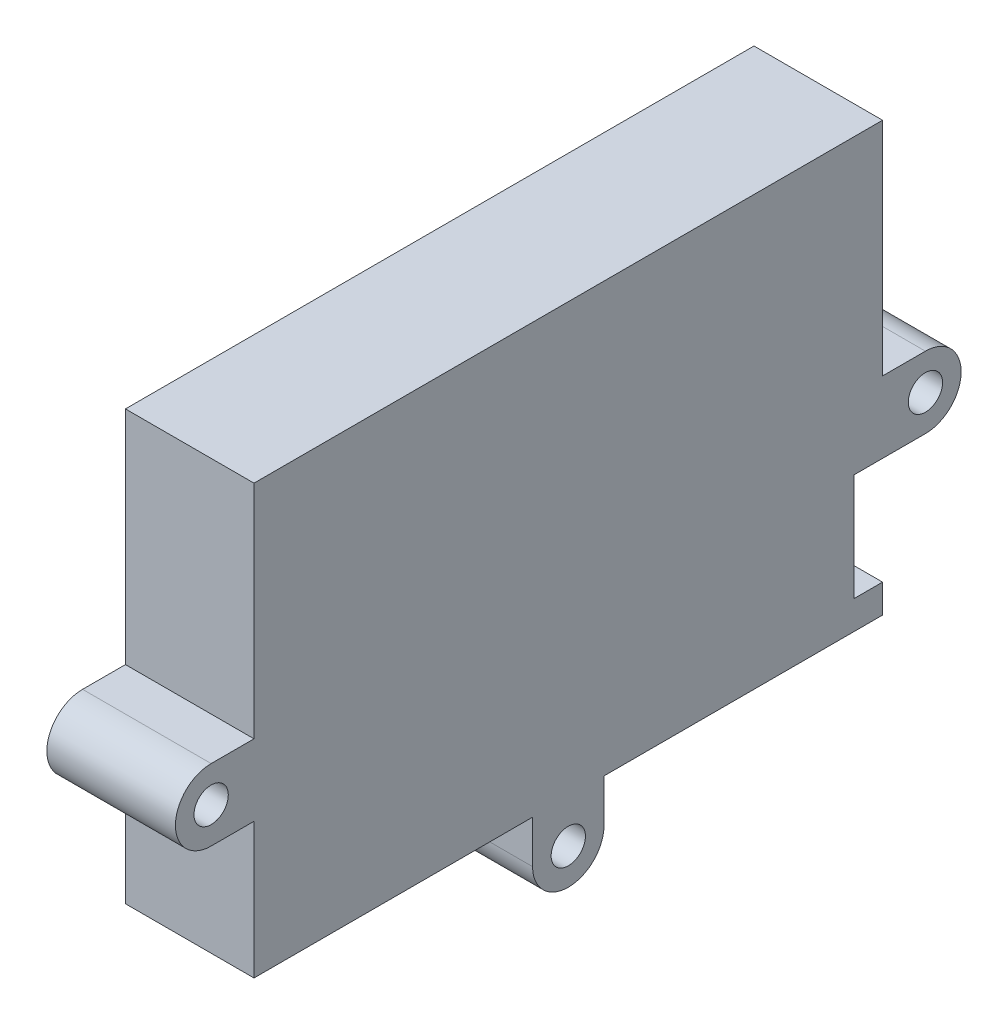
from build123d import *

# Parameters (mm, degrees)
SKETCH1_W           = 50.8
SKETCH1_H           = 33.02
BOSS_EXTRUDE1_DEPTH = 2.54
SKETCH2_R           = 3.175
SKETCH2_R_2         = 1.524
BOSS_EXTRUDE3_DEPTH = 2.54
SKETCH3_W           = 22.225
SKETCH3_H           = 2.54
SKETCH3_W_2         = 6.35
SKETCH3_W_3         = 2.54
SKETCH3_H_2         = 6.35
SKETCH3_H_3         = 17.145
SKETCH3_H_4         = 9.525
BOSS_EXTRUDE4_DEPTH = 11.43
SKETCH5_W           = 2.54
SKETCH5_H           = 9.525
CUT_EXTRUDE2_DEPTH  = 11.43
SKETCH6_R           = 1.524
BOSS_EXTRUDE7_DEPTH = 8.89


with BuildPart() as part:
    # Sketch1 → Boss-Extrude1 (new body)
    with BuildSketch(Plane(origin=(0, 0, 0), x_dir=(0, 0, -1), z_dir=(1, 0, 0))):
        with Locations((25.4, 16.51)):
            Rectangle(SKETCH1_W, SKETCH1_H)
    extrude(amount=BOSS_EXTRUDE1_DEPTH)

    # Sketch2 → Boss-Extrude3 (add)
    # profile 1 of 6: a face of its own
    with BuildSketch(Plane(origin=(2.54, 0, 0), x_dir=(0, 0, -1), z_dir=(1, 0, 0))):
        with BuildLine():
            Line((-6.35, 9.525), (0, 9.525))
            Line((0, 9.525), (0, 15.875))
            Line((0, 15.875), (-6.35, 15.875))
            ThreePointArc((-6.35, 15.875), (-4.10493597, 14.94506403), (-3.175, 12.7))
            ThreePointArc((-3.175, 12.7), (-4.10493597, 10.45493597), (-6.35, 9.525))
        make_face()
    # profile 2 of 6: a face of its own
    with BuildSketch(Plane(origin=(2.54, 0, 0), x_dir=(0, 0, -1), z_dir=(1, 0, 0))):
        with Locations((-6.35, 12.7)):
            Circle(SKETCH2_R)
        with Locations((-6.35, 12.7)):
            Circle(SKETCH2_R_2, mode=Mode.SUBTRACT)
    # profile 3 of 6: a face of its own
    with BuildSketch(Plane(origin=(2.54, 0, 0), x_dir=(0, 0, -1), z_dir=(1, 0, 0))):
        with BuildLine():
            Line((28.575, -6.35), (28.575, 0))
            Line((28.575, 0), (22.225, 0))
            Line((22.225, 0), (22.225, -6.35))
            ThreePointArc((22.225, -6.35), (25.4, -3.175), (28.575, -6.35))
        make_face()
    # profile 4 of 6: a face of its own
    with BuildSketch(Plane(origin=(2.54, 0, 0), x_dir=(0, 0, -1), z_dir=(1, 0, 0))):
        with Locations((25.4, -6.35)):
            Circle(SKETCH2_R)
        with Locations((25.4, -6.35)):
            Circle(SKETCH2_R_2, mode=Mode.SUBTRACT)
    # profile 5 of 6: a face of its own
    with BuildSketch(Plane(origin=(2.54, 0, 0), x_dir=(0, 0, -1), z_dir=(1, 0, 0))):
        with BuildLine():
            Line((50.8, 9.525), (57.15, 9.525))
            ThreePointArc((57.15, 9.525), (53.975, 12.7), (57.15, 15.875))
            Line((57.15, 15.875), (50.8, 15.875))
            Line((50.8, 15.875), (50.8, 9.525))
        make_face()
    # profile 6 of 6: a face of its own
    with BuildSketch(Plane(origin=(2.54, 0, 0), x_dir=(0, 0, -1), z_dir=(1, 0, 0))):
        with Locations((57.15, 12.7)):
            Circle(SKETCH2_R)
        with Locations((57.15, 12.7)):
            Circle(SKETCH2_R_2, mode=Mode.SUBTRACT)
    extrude(amount=-BOSS_EXTRUDE3_DEPTH)

    # Sketch3 → Boss-Extrude4 (add)
    with BuildSketch(Plane(origin=(2.54, 0, 0), x_dir=(0, 0, -1), z_dir=(1, 0, 0))):
        with Locations((39.6875, -1.27)):
            Rectangle(SKETCH3_W, SKETCH3_H)
        Polygon((22.225, 0), (0, 0), (-2.54, 0), (-2.54, -2.54), (22.225, -2.54), align=None)
        with Locations((25.4, -1.27)):
            Rectangle(SKETCH3_W_2, SKETCH3_H)
        Polygon((53.34, 9.525), (50.8, 9.525), (50.8, 0), (50.8, -2.54), (53.34, -2.54), align=None)
        with Locations((52.07, 12.7)):
            Rectangle(SKETCH3_W_3, SKETCH3_H_2)
        with Locations((52.07, 24.4475)):
            Rectangle(SKETCH3_W_3, SKETCH3_H_3)
        Polygon((50.8, 33.02), (53.34, 33.02), (53.34, 35.56), (-2.54, 35.56), (-2.54, 33.02), (0, 33.02), align=None)
        with Locations((-1.27, 24.4475)):
            Rectangle(SKETCH3_W_3, SKETCH3_H_3)
        with Locations((-1.27, 12.7)):
            Rectangle(SKETCH3_W_3, SKETCH3_H_2)
        with Locations((-1.27, 4.7625)):
            Rectangle(SKETCH3_W_3, SKETCH3_H_4)
    extrude(amount=-BOSS_EXTRUDE4_DEPTH)

    # Sketch5 → Cut-Extrude2 (cut)
    with BuildSketch(Plane.ZY.offset(8.89)):
        with Locations((-52.07, 4.7625)):
            Rectangle(SKETCH5_W, SKETCH5_H)
    extrude(amount=-CUT_EXTRUDE2_DEPTH, mode=Mode.SUBTRACT)

    # Sketch6 → Boss-Extrude7 (add)
    # profile 1 of 3: a face of its own
    with BuildSketch(Plane.ZY):
        with BuildLine():
            Line((2.54, 15.875), (2.54, 9.525))
            Line((2.54, 9.525), (6.35, 9.525))
            ThreePointArc((6.35, 9.525), (9.525, 12.7), (6.35, 15.875))
            Line((6.35, 15.875), (2.54, 15.875))
        make_face()
        with Locations(Location((6.35, 12.7, 0), (0, 0, 180))):
            Circle(SKETCH6_R, mode=Mode.SUBTRACT)
    # profile 2 of 3: a face of its own
    with BuildSketch(Plane.ZY):
        with BuildLine():
            Line((-22.225, -2.54), (-28.575, -2.54))
            Line((-28.575, -2.54), (-28.575, -6.35))
            ThreePointArc((-28.575, -6.35), (-25.4, -9.525), (-22.225, -6.35))
            Line((-22.225, -6.35), (-22.225, -2.54))
        make_face()
        with Locations(Location((-25.4, -6.35, 0), (0, 0, 180))):
            Circle(SKETCH6_R, mode=Mode.SUBTRACT)
    # profile 3 of 3: a face of its own
    with BuildSketch(Plane.ZY):
        with BuildLine():
            Line((-53.34, 15.875), (-53.34, 9.525))
            Line((-53.34, 9.525), (-57.15, 9.525))
            ThreePointArc((-57.15, 9.525), (-60.325, 12.7), (-57.15, 15.875))
            Line((-57.15, 15.875), (-53.34, 15.875))
        make_face()
        with Locations(Location((-57.15, 12.7, 0), (0, 0, 180))):
            Circle(SKETCH6_R, mode=Mode.SUBTRACT)
    extrude(amount=BOSS_EXTRUDE7_DEPTH)


solid = part.part
